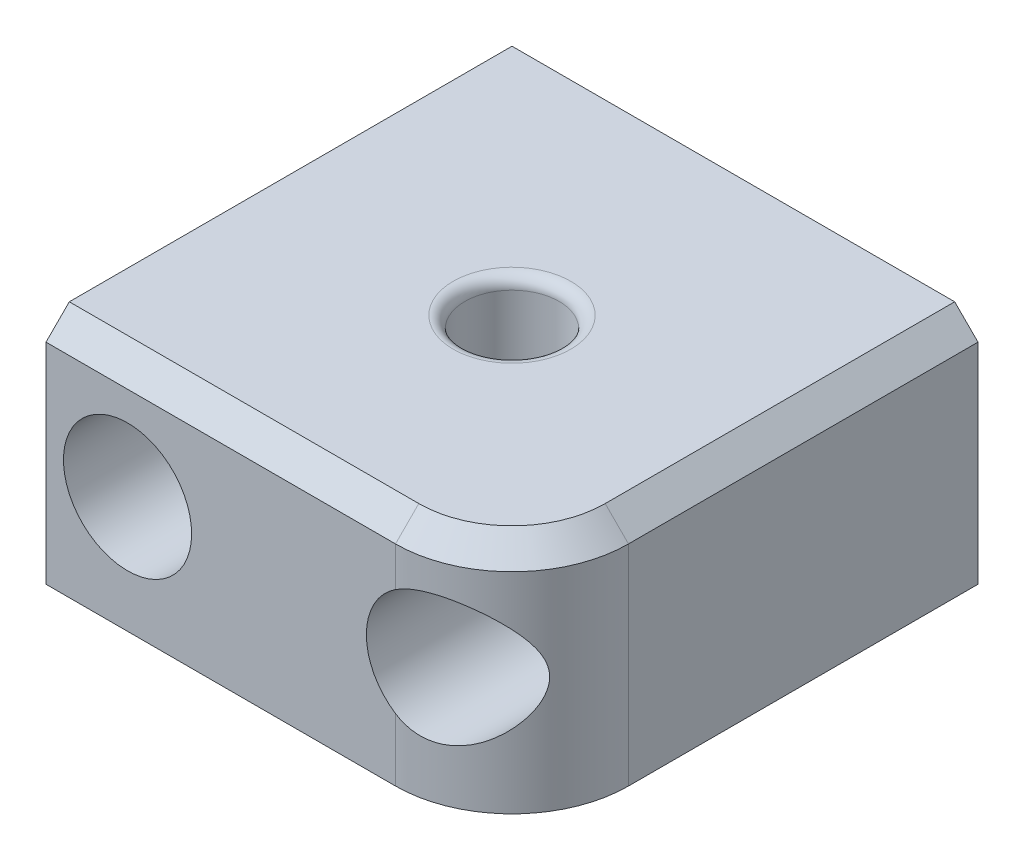
from build123d import *

# Parameters (mm, degrees)
SKETCH1_R           = 4.05
BOSS_EXTRUDE1_DEPTH = 20
SKETCH3_R           = 2.65
CUT_EXTRUDE5_DEPTH  = 40
SKETCH6_R           = 5.5
CUT_EXTRUDE7_DEPTH  = 29
CHAMFER1_SIZE       = 2
FILLET1_R           = 1


with BuildPart() as part:
    # Sketch1 → Boss-Extrude1 (new body)
    with BuildSketch(Plane(origin=(0, 0, 0), x_dir=(1, 0, 0), z_dir=(0, 1, 0))):
        with BuildLine():
            Line((10, -20), (-20, -20))
            Line((-20, -20), (-20, 20))
            Line((-20, 20), (20, 20))
            Line((20, 20), (20, -10))
            ThreePointArc((20, -10), (17.071067812, -17.071067812), (10, -20))
        make_face()
        with Locations(Location((0, 0, 0), (0, 0, 270))):
            Circle(SKETCH1_R, mode=Mode.SUBTRACT)
    extrude(amount=BOSS_EXTRUDE1_DEPTH)

    # Sketch3 → Cut-Extrude5 (cut)
    with BuildSketch(Plane.XY.offset(20)):
        with Locations((-13, 10)):
            Circle(SKETCH3_R)
        with Locations((13, 10)):
            Circle(SKETCH3_R)
    extrude(amount=-CUT_EXTRUDE5_DEPTH, mode=Mode.SUBTRACT)

    # Sketch6 → Cut-Extrude7 (cut)
    with BuildSketch(Plane.XY.offset(20)):
        with Locations((-13, 10)):
            Circle(SKETCH6_R)
        with Locations((13, 10)):
            Circle(SKETCH6_R)
    extrude(amount=-CUT_EXTRUDE7_DEPTH, mode=Mode.SUBTRACT)

    # Chamfer1
    chamfer1_edges = [part.edges().sort_by_distance(p)[0] for p in [
        (17.071067812, 20, 17.071067812),
        (20, 20, -5),
        (-5, 20, 20),
    ]]
    chamfer(chamfer1_edges, length=CHAMFER1_SIZE)

    # Fillet1
    fillet1_edges = [part.edges().sort_by_distance(p)[0] for p in [
        (0, 20, -4.05),
    ]]
    fillet(fillet1_edges, radius=FILLET1_R)


solid = part.part
